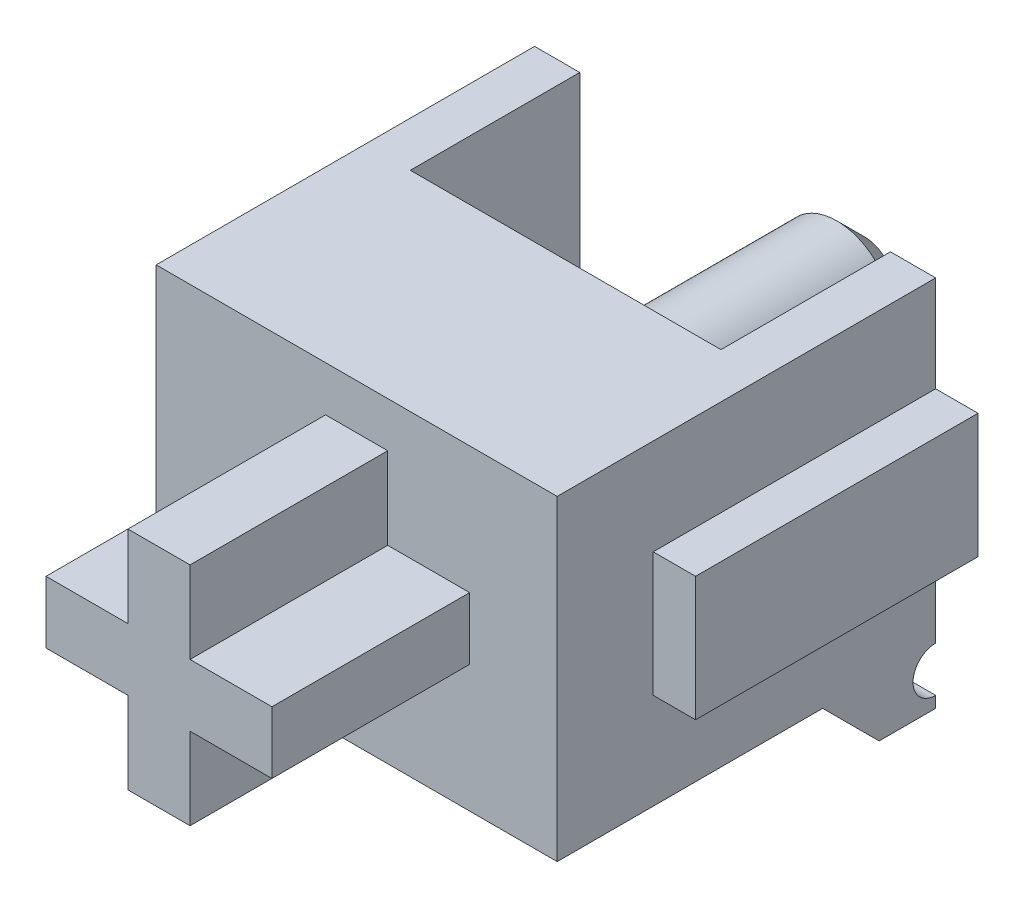
from build123d import *

# Parameters (mm, degrees)
SKETCH1_W               = 7.1
SKETCH1_H               = 5.6
BOSS_EXTRUDE1_DEPTH     = 3.35
SKETCH2_W               = 4
SKETCH2_H               = 4
BOSS_EXTRUDE2_DEPTH     = 3.5
SKETCH3_W               = 1.45
SKETCH3_H               = 1.45
CUT_EXTRUDE1_DEPTH      = 3.5
MIRROR2_COPY_1_SKETCH_W = 1.45
MIRROR2_COPY_1_SKETCH_H = 1.45
MIRROR2_COPY_1_DEPTH    = 3.5
SKETCH4_W               = 5
SKETCH4_H               = 2.2
BOSS_EXTRUDE3_DEPTH     = 0.75
SKETCH5_W               = 5.5
SKETCH5_H               = 5.6
CUT_EXTRUDE2_DEPTH      = 3
SKETCH6_R               = 2.4
CUT_EXTRUDE3_DEPTH      = 2
SKETCH7_R               = 1
BOSS_EXTRUDE4_DEPTH     = 7.3
CHAMFER1_SIZE           = 0.5
BOSS_EXTRUDE5_DEPTH     = 0.8
SKETCH9_R               = 0.4
CUT_EXTRUDE4_DEPTH      = 0.8


with BuildPart() as part:
    # Sketch1 → Boss-Extrude1 (new, symmetric)
    with BuildSketch(Plane.XY):
        Rectangle(SKETCH1_W, SKETCH1_H)
    extrude(amount=BOSS_EXTRUDE1_DEPTH, both=True)

    # Sketch2 → Boss-Extrude2 (add)
    with BuildSketch(Plane.XY.offset(3.35)):
        Rectangle(SKETCH2_W, SKETCH2_H)
    extrude(amount=BOSS_EXTRUDE2_DEPTH)

    # Sketch3 → Cut-Extrude1 (cut)
    with BuildSketch(Plane.XY.offset(6.85)):
        with Locations((-1.275, 1.275)):
            Rectangle(SKETCH3_W, SKETCH3_H)
    cut_extrude1 = extrude(amount=-CUT_EXTRUDE1_DEPTH, mode=Mode.SUBTRACT)

    # Mirror1: Cut-Extrude1 across plane
    add(cut_extrude1.mirror(Plane(origin=(0, 0, 0), x_dir=(0, 0, 1), z_dir=(1, 0, 0))), mode=Mode.SUBTRACT)

    # Mirror2: Cut-Extrude1 across plane
    add(cut_extrude1.mirror(Plane.ZX), mode=Mode.SUBTRACT)

    # Mirror2 copy 1 sketch → Mirror2 copy 1 (cut)
    with BuildSketch(Plane(origin=(0, 0, 6.85), x_dir=(-1, 0, 0), z_dir=(0, 0, 1))):
        with Locations((-1.275, 1.275)):
            Rectangle(MIRROR2_COPY_1_SKETCH_W, MIRROR2_COPY_1_SKETCH_H)
    extrude(amount=-MIRROR2_COPY_1_DEPTH, mode=Mode.SUBTRACT)

    # Sketch4 → Boss-Extrude3 (add)
    with BuildSketch(Plane.ZY.offset(3.55)):
        with Locations((-0.85, 0)):
            Rectangle(SKETCH4_W, SKETCH4_H)
    boss_extrude3 = extrude(amount=BOSS_EXTRUDE3_DEPTH)

    # Mirror3: Boss-Extrude3 across plane
    add(boss_extrude3.mirror(Plane(origin=(0, 0, 0), x_dir=(0, 0, 1), z_dir=(1, 0, 0))))

    # Sketch5 → Cut-Extrude2 (cut)
    with BuildSketch(Plane(origin=(0, 0, -3.35), x_dir=(-1, 0, 0), z_dir=(0, 0, -1))):
        Rectangle(SKETCH5_W, SKETCH5_H)
    extrude(amount=-CUT_EXTRUDE2_DEPTH, mode=Mode.SUBTRACT)

    # Sketch6 → Cut-Extrude3 (cut)
    with BuildSketch(Plane(origin=(0, 0, -0.35), x_dir=(-1, 0, 0), z_dir=(0, 0, -1))):
        Circle(SKETCH6_R)
    extrude(amount=-CUT_EXTRUDE3_DEPTH, mode=Mode.SUBTRACT)

    # Sketch7 → Boss-Extrude4 (add)
    with BuildSketch(Plane(origin=(0, 0, 1.65), x_dir=(-1, 0, 0), z_dir=(0, 0, -1))):
        Circle(SKETCH7_R)
    extrude(amount=BOSS_EXTRUDE4_DEPTH)

    # Chamfer1
    chamfer1_edges = [part.edges().sort_by_distance(p)[0] for p in [
        (1, 0, -5.65),
    ]]
    chamfer(chamfer1_edges, length=CHAMFER1_SIZE)

    # Sketch8 → Boss-Extrude5 (add)
    with BuildSketch(Plane(origin=(3.55, 0, 0), x_dir=(0, 0, -1), z_dir=(1, 0, 0))):
        Polygon((1.35, -2.8), (2.35, -3.8), (3.35, -3.8), (3.35, -2.8), align=None)
    boss_extrude5 = extrude(amount=-BOSS_EXTRUDE5_DEPTH)

    # Sketch9 → Cut-Extrude4 (cut)
    with BuildSketch(Plane(origin=(3.55, 0, 0), x_dir=(0, 0, -1), z_dir=(1, 0, 0))):
        with Locations((3.35, -3.2)):
            Circle(SKETCH9_R)
    cut_extrude4 = extrude(amount=-CUT_EXTRUDE4_DEPTH, mode=Mode.SUBTRACT)

    # Mirror4: Boss-Extrude5, Cut-Extrude4 across plane
    add(boss_extrude5.mirror(Plane(origin=(0, 0, 0), x_dir=(0, 0, 1), z_dir=(1, 0, 0))))
    add(cut_extrude4.mirror(Plane(origin=(0, 0, 0), x_dir=(0, 0, 1), z_dir=(1, 0, 0))), mode=Mode.SUBTRACT)


solid = part.part
